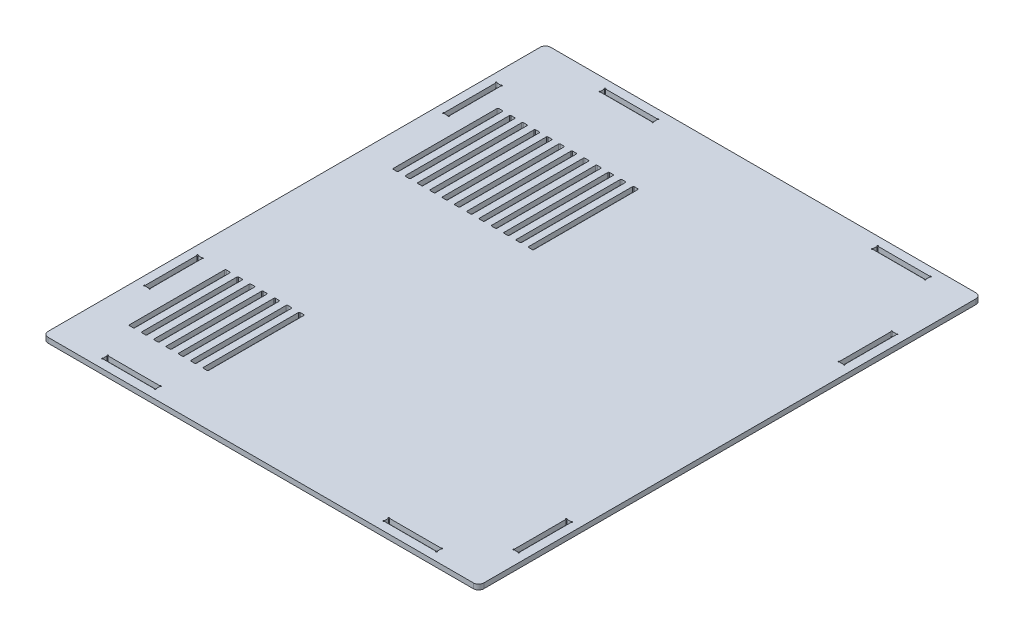
from build123d import *

# Parameters (mm, degrees)
BOSS_EXTRUDE1_DEPTH = 2.9


with BuildPart() as part:
    # Sketch1 → Boss-Extrude1 (new body)
    with BuildSketch(Plane(origin=(0, 81.9, 0), x_dir=(1, 0, 0), z_dir=(0, 1, 0))):
        with BuildLine():
            Line((-120.9, -142.9), (120.9, -142.9))
            ThreePointArc((120.9, -142.9), (123.021320344, -142.021320344), (123.9, -139.9))
            Line((123.9, -139.9), (123.9, 139.9))
            ThreePointArc((123.9, 139.9), (123.021320344, 142.021320344), (120.9, 142.9))
            Line((120.9, 142.9), (-120.9, 142.9))
            ThreePointArc((-120.9, 142.9), (-123.021320344, 142.021320344), (-123.9, 139.9))
            Line((-123.9, 139.9), (-123.9, -139.9))
            ThreePointArc((-123.9, -139.9), (-123.021320344, -142.021320344), (-120.9, -142.9))
        make_face()
        with BuildLine():
            Line((-94.6875, -137.95), (-65.3125, -137.95))
            ThreePointArc((-65.3125, -137.95), (-64.715012627, -138.197487373), (-64.9625, -137.6))
            Line((-64.9625, -137.6), (-64.9625, -135.3))
            ThreePointArc((-64.9625, -135.3), (-64.715012627, -134.702512627), (-65.3125, -134.95))
            Line((-65.3125, -134.95), (-94.6875, -134.95))
            ThreePointArc((-94.6875, -134.95), (-95.284987373, -134.702512627), (-95.0375, -135.3))
            Line((-95.0375, -135.3), (-95.0375, -137.6))
            ThreePointArc((-95.0375, -137.6), (-95.284987373, -138.197487373), (-94.6875, -137.95))
        make_face(mode=Mode.SUBTRACT)
        with BuildLine():
            Line((65.3125, -137.95), (94.6875, -137.95))
            ThreePointArc((94.6875, -137.95), (95.284987373, -138.197487373), (95.0375, -137.6))
            Line((95.0375, -137.6), (95.0375, -135.3))
            ThreePointArc((95.0375, -135.3), (95.284987373, -134.702512627), (94.6875, -134.95))
            Line((94.6875, -134.95), (65.3125, -134.95))
            ThreePointArc((65.3125, -134.95), (64.715012627, -134.702512627), (64.9625, -135.3))
            Line((64.9625, -135.3), (64.9625, -137.6))
            ThreePointArc((64.9625, -137.6), (64.715012627, -138.197487373), (65.3125, -137.95))
        make_face(mode=Mode.SUBTRACT)
        with BuildLine():
            Line((-84.6875, 134.95), (-55.3125, 134.95))
            ThreePointArc((-55.3125, 134.95), (-54.715012627, 134.702512627), (-54.9625, 135.3))
            Line((-54.9625, 135.3), (-54.9625, 137.6))
            ThreePointArc((-54.9625, 137.6), (-54.715012627, 138.197487373), (-55.3125, 137.95))
            Line((-55.3125, 137.95), (-84.6875, 137.95))
            ThreePointArc((-84.6875, 137.95), (-85.284987373, 138.197487373), (-85.0375, 137.6))
            Line((-85.0375, 137.6), (-85.0375, 135.3))
            ThreePointArc((-85.0375, 135.3), (-85.284987373, 134.702512627), (-84.6875, 134.95))
        make_face(mode=Mode.SUBTRACT)
        with BuildLine():
            Line((70.3125, 134.95), (99.6875, 134.95))
            ThreePointArc((99.6875, 134.95), (100.284987373, 134.702512627), (100.0375, 135.3))
            Line((100.0375, 135.3), (100.0375, 137.6))
            ThreePointArc((100.0375, 137.6), (100.284987373, 138.197487373), (99.6875, 137.95))
            Line((99.6875, 137.95), (70.3125, 137.95))
            ThreePointArc((70.3125, 137.95), (69.715012627, 138.197487373), (69.9625, 137.6))
            Line((69.9625, 137.6), (69.9625, 135.3))
            ThreePointArc((69.9625, 135.3), (69.715012627, 134.702512627), (70.3125, 134.95))
        make_face(mode=Mode.SUBTRACT)
        with BuildLine():
            Line((116.3, -115.0375), (118.6, -115.0375))
            ThreePointArc((118.6, -115.0375), (119.197487373, -115.284987373), (118.95, -114.6875))
            Line((118.95, -114.6875), (118.95, -85.3125))
            ThreePointArc((118.95, -85.3125), (119.197487373, -84.715012627), (118.6, -84.9625))
            Line((118.6, -84.9625), (116.3, -84.9625))
            ThreePointArc((116.3, -84.9625), (115.702512627, -84.715012627), (115.95, -85.3125))
            Line((115.95, -85.3125), (115.95, -114.6875))
            ThreePointArc((115.95, -114.6875), (115.702512627, -115.284987373), (116.3, -115.0375))
        make_face(mode=Mode.SUBTRACT)
        with BuildLine():
            Line((116.3, 69.9625), (118.6, 69.9625))
            ThreePointArc((118.6, 69.9625), (119.197487373, 69.715012627), (118.95, 70.3125))
            Line((118.95, 70.3125), (118.95, 99.6875))
            ThreePointArc((118.95, 99.6875), (119.197487373, 100.284987373), (118.6, 100.0375))
            Line((118.6, 100.0375), (116.3, 100.0375))
            ThreePointArc((116.3, 100.0375), (115.702512627, 100.284987373), (115.95, 99.6875))
            Line((115.95, 99.6875), (115.95, 70.3125))
            ThreePointArc((115.95, 70.3125), (115.702512627, 69.715012627), (116.3, 69.9625))
        make_face(mode=Mode.SUBTRACT)
        with BuildLine():
            Line((-118.6, -90.0375), (-116.3, -90.0375))
            ThreePointArc((-116.3, -90.0375), (-115.702512627, -90.284987373), (-115.95, -89.6875))
            Line((-115.95, -89.6875), (-115.95, -60.3125))
            ThreePointArc((-115.95, -60.3125), (-115.702512627, -59.715012627), (-116.3, -59.9625))
            Line((-116.3, -59.9625), (-118.6, -59.9625))
            ThreePointArc((-118.6, -59.9625), (-119.197487373, -59.715012627), (-118.95, -60.3125))
            Line((-118.95, -60.3125), (-118.95, -89.6875))
            ThreePointArc((-118.95, -89.6875), (-119.197487373, -90.284987373), (-118.6, -90.0375))
        make_face(mode=Mode.SUBTRACT)
        with BuildLine():
            Line((-118.6, 79.9625), (-116.3, 79.9625))
            ThreePointArc((-116.3, 79.9625), (-115.702512627, 79.715012627), (-115.95, 80.3125))
            Line((-115.95, 80.3125), (-115.95, 109.6875))
            ThreePointArc((-115.95, 109.6875), (-115.702512627, 110.284987373), (-116.3, 110.0375))
            Line((-116.3, 110.0375), (-118.6, 110.0375))
            ThreePointArc((-118.6, 110.0375), (-119.197487373, 110.284987373), (-118.95, 109.6875))
            Line((-118.95, 109.6875), (-118.95, 80.3125))
            ThreePointArc((-118.95, 80.3125), (-119.197487373, 79.715012627), (-118.6, 79.9625))
        make_face(mode=Mode.SUBTRACT)
        with BuildLine():
            Line((-103.5, -114), (-101.5, -114))
            ThreePointArc((-101.5, -114), (-101.146446609, -113.853553391), (-101, -113.5))
            Line((-101, -113.5), (-101, -59.5))
            ThreePointArc((-101, -59.5), (-101.146446609, -59.146446609), (-101.5, -59))
            Line((-101.5, -59), (-103.5, -59))
            ThreePointArc((-103.5, -59), (-103.853553391, -59.146446609), (-104, -59.5))
            Line((-104, -59.5), (-104, -113.5))
            ThreePointArc((-104, -113.5), (-103.853553391, -113.853553391), (-103.5, -114))
        make_face(mode=Mode.SUBTRACT)
        with BuildLine():
            Line((-96.5, -114), (-94.5, -114))
            ThreePointArc((-94.5, -114), (-94.146446609, -113.853553391), (-94, -113.5))
            Line((-94, -113.5), (-94, -59.5))
            ThreePointArc((-94, -59.5), (-94.146446609, -59.146446609), (-94.5, -59))
            Line((-94.5, -59), (-96.5, -59))
            ThreePointArc((-96.5, -59), (-96.853553391, -59.146446609), (-97, -59.5))
            Line((-97, -59.5), (-97, -113.5))
            ThreePointArc((-97, -113.5), (-96.853553391, -113.853553391), (-96.5, -114))
        make_face(mode=Mode.SUBTRACT)
        with BuildLine():
            Line((-89.5, -114), (-87.5, -114))
            ThreePointArc((-87.5, -114), (-87.146446609, -113.853553391), (-87, -113.5))
            Line((-87, -113.5), (-87, -59.5))
            ThreePointArc((-87, -59.5), (-87.146446609, -59.146446609), (-87.5, -59))
            Line((-87.5, -59), (-89.5, -59))
            ThreePointArc((-89.5, -59), (-89.853553391, -59.146446609), (-90, -59.5))
            Line((-90, -59.5), (-90, -113.5))
            ThreePointArc((-90, -113.5), (-89.853553391, -113.853553391), (-89.5, -114))
        make_face(mode=Mode.SUBTRACT)
        with BuildLine():
            Line((-82.5, -114), (-80.5, -114))
            ThreePointArc((-80.5, -114), (-80.146446609, -113.853553391), (-80, -113.5))
            Line((-80, -113.5), (-80, -59.5))
            ThreePointArc((-80, -59.5), (-80.146446609, -59.146446609), (-80.5, -59))
            Line((-80.5, -59), (-82.5, -59))
            ThreePointArc((-82.5, -59), (-82.853553391, -59.146446609), (-83, -59.5))
            Line((-83, -59.5), (-83, -113.5))
            ThreePointArc((-83, -113.5), (-82.853553391, -113.853553391), (-82.5, -114))
        make_face(mode=Mode.SUBTRACT)
        with BuildLine():
            Line((-75.5, -114), (-73.5, -114))
            ThreePointArc((-73.5, -114), (-73.146446609, -113.853553391), (-73, -113.5))
            Line((-73, -113.5), (-73, -59.5))
            ThreePointArc((-73, -59.5), (-73.146446609, -59.146446609), (-73.5, -59))
            Line((-73.5, -59), (-75.5, -59))
            ThreePointArc((-75.5, -59), (-75.853553391, -59.146446609), (-76, -59.5))
            Line((-76, -59.5), (-76, -113.5))
            ThreePointArc((-76, -113.5), (-75.853553391, -113.853553391), (-75.5, -114))
        make_face(mode=Mode.SUBTRACT)
        with BuildLine():
            Line((-68.5, -114), (-66.5, -114))
            ThreePointArc((-66.5, -114), (-66.146446609, -113.853553391), (-66, -113.5))
            Line((-66, -113.5), (-66, -59.5))
            ThreePointArc((-66, -59.5), (-66.146446609, -59.146446609), (-66.5, -59))
            Line((-66.5, -59), (-68.5, -59))
            ThreePointArc((-68.5, -59), (-68.853553391, -59.146446609), (-69, -59.5))
            Line((-69, -59.5), (-69, -113.5))
            ThreePointArc((-69, -113.5), (-68.853553391, -113.853553391), (-68.5, -114))
        make_face(mode=Mode.SUBTRACT)
        with BuildLine():
            Line((-61.5, -114), (-59.5, -114))
            ThreePointArc((-59.5, -114), (-59.146446609, -113.853553391), (-59, -113.5))
            Line((-59, -113.5), (-59, -59.5))
            ThreePointArc((-59, -59.5), (-59.146446609, -59.146446609), (-59.5, -59))
            Line((-59.5, -59), (-61.5, -59))
            ThreePointArc((-61.5, -59), (-61.853553391, -59.146446609), (-62, -59.5))
            Line((-62, -59.5), (-62, -113.5))
            ThreePointArc((-62, -113.5), (-61.853553391, -113.853553391), (-61.5, -114))
        make_face(mode=Mode.SUBTRACT)
        with BuildLine():
            Line((-105.5, 38), (-103.5, 38))
            ThreePointArc((-103.5, 38), (-103.146446609, 38.146446609), (-103, 38.5))
            Line((-103, 38.5), (-103, 97.5))
            ThreePointArc((-103, 97.5), (-103.146446609, 97.853553391), (-103.5, 98))
            Line((-103.5, 98), (-105.5, 98))
            ThreePointArc((-105.5, 98), (-105.853553391, 97.853553391), (-106, 97.5))
            Line((-106, 97.5), (-106, 38.5))
            ThreePointArc((-106, 38.5), (-105.853553391, 38.146446609), (-105.5, 38))
        make_face(mode=Mode.SUBTRACT)
        with BuildLine():
            Line((-98.5, 38), (-96.5, 38))
            ThreePointArc((-96.5, 38), (-96.146446609, 38.146446609), (-96, 38.5))
            Line((-96, 38.5), (-96, 97.5))
            ThreePointArc((-96, 97.5), (-96.146446609, 97.853553391), (-96.5, 98))
            Line((-96.5, 98), (-98.5, 98))
            ThreePointArc((-98.5, 98), (-98.853553391, 97.853553391), (-99, 97.5))
            Line((-99, 97.5), (-99, 38.5))
            ThreePointArc((-99, 38.5), (-98.853553391, 38.146446609), (-98.5, 38))
        make_face(mode=Mode.SUBTRACT)
        with BuildLine():
            Line((-91.5, 38), (-89.5, 38))
            ThreePointArc((-89.5, 38), (-89.146446609, 38.146446609), (-89, 38.5))
            Line((-89, 38.5), (-89, 97.5))
            ThreePointArc((-89, 97.5), (-89.146446609, 97.853553391), (-89.5, 98))
            Line((-89.5, 98), (-91.5, 98))
            ThreePointArc((-91.5, 98), (-91.853553391, 97.853553391), (-92, 97.5))
            Line((-92, 97.5), (-92, 38.5))
            ThreePointArc((-92, 38.5), (-91.853553391, 38.146446609), (-91.5, 38))
        make_face(mode=Mode.SUBTRACT)
        with BuildLine():
            Line((-84.5, 38), (-82.5, 38))
            ThreePointArc((-82.5, 38), (-82.146446609, 38.146446609), (-82, 38.5))
            Line((-82, 38.5), (-82, 97.5))
            ThreePointArc((-82, 97.5), (-82.146446609, 97.853553391), (-82.5, 98))
            Line((-82.5, 98), (-84.5, 98))
            ThreePointArc((-84.5, 98), (-84.853553391, 97.853553391), (-85, 97.5))
            Line((-85, 97.5), (-85, 38.5))
            ThreePointArc((-85, 38.5), (-84.853553391, 38.146446609), (-84.5, 38))
        make_face(mode=Mode.SUBTRACT)
        with BuildLine():
            Line((-77.5, 38), (-75.5, 38))
            ThreePointArc((-75.5, 38), (-75.146446609, 38.146446609), (-75, 38.5))
            Line((-75, 38.5), (-75, 97.5))
            ThreePointArc((-75, 97.5), (-75.146446609, 97.853553391), (-75.5, 98))
            Line((-75.5, 98), (-77.5, 98))
            ThreePointArc((-77.5, 98), (-77.853553391, 97.853553391), (-78, 97.5))
            Line((-78, 97.5), (-78, 38.5))
            ThreePointArc((-78, 38.5), (-77.853553391, 38.146446609), (-77.5, 38))
        make_face(mode=Mode.SUBTRACT)
        with BuildLine():
            Line((-70.5, 38), (-68.5, 38))
            ThreePointArc((-68.5, 38), (-68.146446609, 38.146446609), (-68, 38.5))
            Line((-68, 38.5), (-68, 97.5))
            ThreePointArc((-68, 97.5), (-68.146446609, 97.853553391), (-68.5, 98))
            Line((-68.5, 98), (-70.5, 98))
            ThreePointArc((-70.5, 98), (-70.853553391, 97.853553391), (-71, 97.5))
            Line((-71, 97.5), (-71, 38.5))
            ThreePointArc((-71, 38.5), (-70.853553391, 38.146446609), (-70.5, 38))
        make_face(mode=Mode.SUBTRACT)
        with BuildLine():
            Line((-63.5, 38), (-61.5, 38))
            ThreePointArc((-61.5, 38), (-61.146446609, 38.146446609), (-61, 38.5))
            Line((-61, 38.5), (-61, 97.5))
            ThreePointArc((-61, 97.5), (-61.146446609, 97.853553391), (-61.5, 98))
            Line((-61.5, 98), (-63.5, 98))
            ThreePointArc((-63.5, 98), (-63.853553391, 97.853553391), (-64, 97.5))
            Line((-64, 97.5), (-64, 38.5))
            ThreePointArc((-64, 38.5), (-63.853553391, 38.146446609), (-63.5, 38))
        make_face(mode=Mode.SUBTRACT)
        with BuildLine():
            Line((-56.5, 38), (-54.5, 38))
            ThreePointArc((-54.5, 38), (-54.146446609, 38.146446609), (-54, 38.5))
            Line((-54, 38.5), (-54, 97.5))
            ThreePointArc((-54, 97.5), (-54.146446609, 97.853553391), (-54.5, 98))
            Line((-54.5, 98), (-56.5, 98))
            ThreePointArc((-56.5, 98), (-56.853553391, 97.853553391), (-57, 97.5))
            Line((-57, 97.5), (-57, 38.5))
            ThreePointArc((-57, 38.5), (-56.853553391, 38.146446609), (-56.5, 38))
        make_face(mode=Mode.SUBTRACT)
        with BuildLine():
            Line((-49.5, 38), (-47.5, 38))
            ThreePointArc((-47.5, 38), (-47.146446609, 38.146446609), (-47, 38.5))
            Line((-47, 38.5), (-47, 97.5))
            ThreePointArc((-47, 97.5), (-47.146446609, 97.853553391), (-47.5, 98))
            Line((-47.5, 98), (-49.5, 98))
            ThreePointArc((-49.5, 98), (-49.853553391, 97.853553391), (-50, 97.5))
            Line((-50, 97.5), (-50, 38.5))
            ThreePointArc((-50, 38.5), (-49.853553391, 38.146446609), (-49.5, 38))
        make_face(mode=Mode.SUBTRACT)
        with BuildLine():
            Line((-42.5, 38), (-40.5, 38))
            ThreePointArc((-40.5, 38), (-40.146446609, 38.146446609), (-40, 38.5))
            Line((-40, 38.5), (-40, 97.5))
            ThreePointArc((-40, 97.5), (-40.146446609, 97.853553391), (-40.5, 98))
            Line((-40.5, 98), (-42.5, 98))
            ThreePointArc((-42.5, 98), (-42.853553391, 97.853553391), (-43, 97.5))
            Line((-43, 97.5), (-43, 38.5))
            ThreePointArc((-43, 38.5), (-42.853553391, 38.146446609), (-42.5, 38))
        make_face(mode=Mode.SUBTRACT)
        with BuildLine():
            Line((-35.5, 38), (-33.5, 38))
            ThreePointArc((-33.5, 38), (-33.146446609, 38.146446609), (-33, 38.5))
            Line((-33, 38.5), (-33, 97.5))
            ThreePointArc((-33, 97.5), (-33.146446609, 97.853553391), (-33.5, 98))
            Line((-33.5, 98), (-35.5, 98))
            ThreePointArc((-35.5, 98), (-35.853553391, 97.853553391), (-36, 97.5))
            Line((-36, 97.5), (-36, 38.5))
            ThreePointArc((-36, 38.5), (-35.853553391, 38.146446609), (-35.5, 38))
        make_face(mode=Mode.SUBTRACT)
        with BuildLine():
            Line((-28.5, 38), (-26.5, 38))
            ThreePointArc((-26.5, 38), (-26.146446609, 38.146446609), (-26, 38.5))
            Line((-26, 38.5), (-26, 97.5))
            ThreePointArc((-26, 97.5), (-26.146446609, 97.853553391), (-26.5, 98))
            Line((-26.5, 98), (-28.5, 98))
            ThreePointArc((-28.5, 98), (-28.853553391, 97.853553391), (-29, 97.5))
            Line((-29, 97.5), (-29, 38.5))
            ThreePointArc((-29, 38.5), (-28.853553391, 38.146446609), (-28.5, 38))
        make_face(mode=Mode.SUBTRACT)
    extrude(amount=BOSS_EXTRUDE1_DEPTH)


solid = part.part
